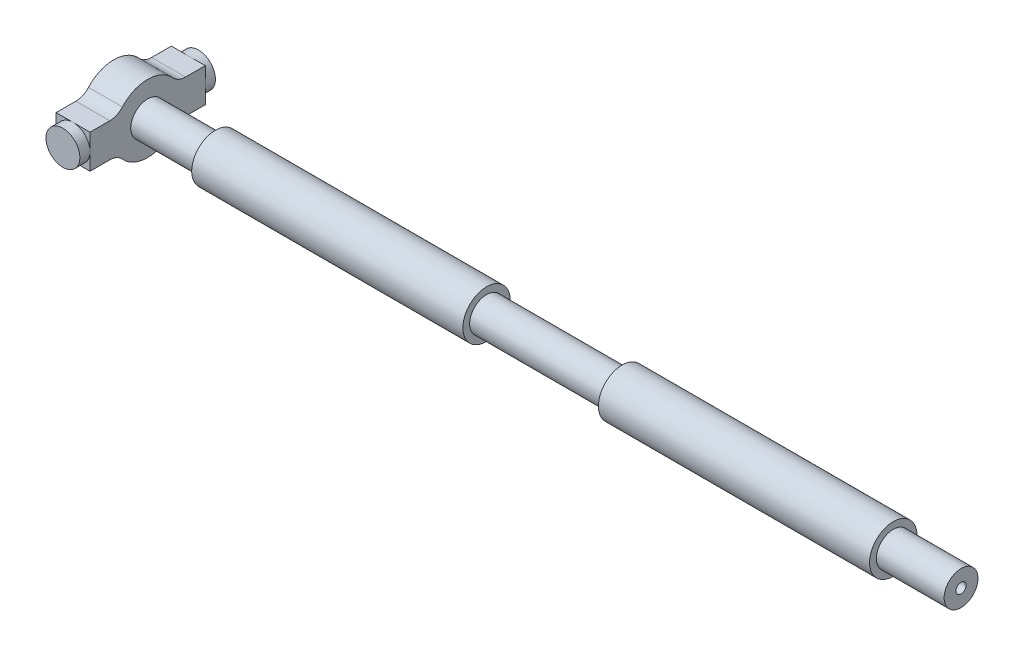
from build123d import *

# Parameters (mm, degrees)
PRIMARY_TUBE_SKETCH_R      = 5
PRIMARY_TUBE_EXTRUDE_DEPTH = 250
THICK_START                = -20
THICK_TUBE_SKETCH_R        = 7
THICK_TUBE_EXTRUDE_1_DEPTH = 80
THICK_START_2              = -140
SKETCH1_2_R                = 7
THICK_TUBE_EXTRUDE_2_DEPTH = 80
PLUNGER_SKETCH_R           = 1.5
PLUNGER_CUT_DEPTH          = 100
T_SUPPORT_EXTRUDE_DEPTH    = 10
T_SUPPORT_FILLET_R         = 5
ARM_PIN_SKETCH_R           = 5
ARM_PIN_EXTRUDE_1_DEPTH    = 3
ARM_START                  = -34
ARM_PIN_SKETCH_2_R         = 5
ARM_PIN_EXTRUDE_2_DEPTH    = 3


with BuildPart() as part:
    # Primary Tube Sketch → Primary Tube Extrude (new body)
    with BuildSketch(Plane(origin=(0, 0, 0), x_dir=(0, 0, -1), z_dir=(1, 0, 0))):
        Circle(PRIMARY_TUBE_SKETCH_R)
    extrude(amount=PRIMARY_TUBE_EXTRUDE_DEPTH)

    # Thick Tube Sketch → Thick Tube Extrude 1 (add)
    with BuildSketch(Plane(origin=(250, 0, 0), x_dir=(0, 0, -1), z_dir=(1, 0, 0)).offset(THICK_START)):
        Circle(THICK_TUBE_SKETCH_R)
    extrude(amount=-THICK_TUBE_EXTRUDE_1_DEPTH)

    # Sketch1<2> → Thick Tube Extrude 2 (add)
    with BuildSketch(Plane(origin=(250, 0, 0), x_dir=(0, 0, -1), z_dir=(1, 0, 0)).offset(THICK_START_2)):
        Circle(SKETCH1_2_R)
    extrude(amount=-THICK_TUBE_EXTRUDE_2_DEPTH)

    # Plunger Sketch → Plunger Cut (cut)
    with BuildSketch(Plane(origin=(250, 0, 0), x_dir=(0, 0, -1), z_dir=(1, 0, 0))):
        Circle(PLUNGER_SKETCH_R)
    extrude(amount=-PLUNGER_CUT_DEPTH, mode=Mode.SUBTRACT)


with BuildPart() as body_2:
    # T Support Sketch → T Support Extrude (new body)
    with BuildSketch(Plane.ZY):
        with BuildLine():
            Line((8.660254038, 5), (17, 5))
            Line((17, 5), (17, -5))
            Line((17, -5), (8.660254038, -5))
            ThreePointArc((8.660254038, -5), (0, -10), (-8.660254038, -5))
            Line((-8.660254038, -5), (-17, -5))
            Line((-17, -5), (-17, 5))
            Line((-17, 5), (-8.660254038, 5))
            ThreePointArc((-8.660254038, 5), (0, 10), (8.660254038, 5))
        make_face()
    extrude(amount=-T_SUPPORT_EXTRUDE_DEPTH)

    # T Support Fillet
    t_support_fillet_edges = [body_2.edges().sort_by_distance(p)[0] for p in [
        (5, -5, 8.660254038),
        (5, -5, -8.660254038),
        (5, 5, -8.660254038),
        (5, 5, 8.660254038),
    ]]
    fillet(t_support_fillet_edges, radius=T_SUPPORT_FILLET_R)


with BuildPart() as body_3:
    # Arm Pin Sketch → Arm Pin Extrude 1 (new body)
    with BuildSketch(Plane.XY.offset(17)):
        with Locations((5, 0)):
            Circle(ARM_PIN_SKETCH_R)
    extrude(amount=ARM_PIN_EXTRUDE_1_DEPTH)


with BuildPart() as body_4:
    # Arm Pin Sketch<2> → Arm Pin Extrude 2 (new body)
    with BuildSketch(Plane.XY.offset(17).offset(ARM_START)):
        with Locations(Location((5, 0, 0), (0, 0, 180))):
            Circle(ARM_PIN_SKETCH_2_R)
    extrude(amount=-ARM_PIN_EXTRUDE_2_DEPTH)


solid = Compound([part.part, body_2.part, body_3.part, body_4.part])
